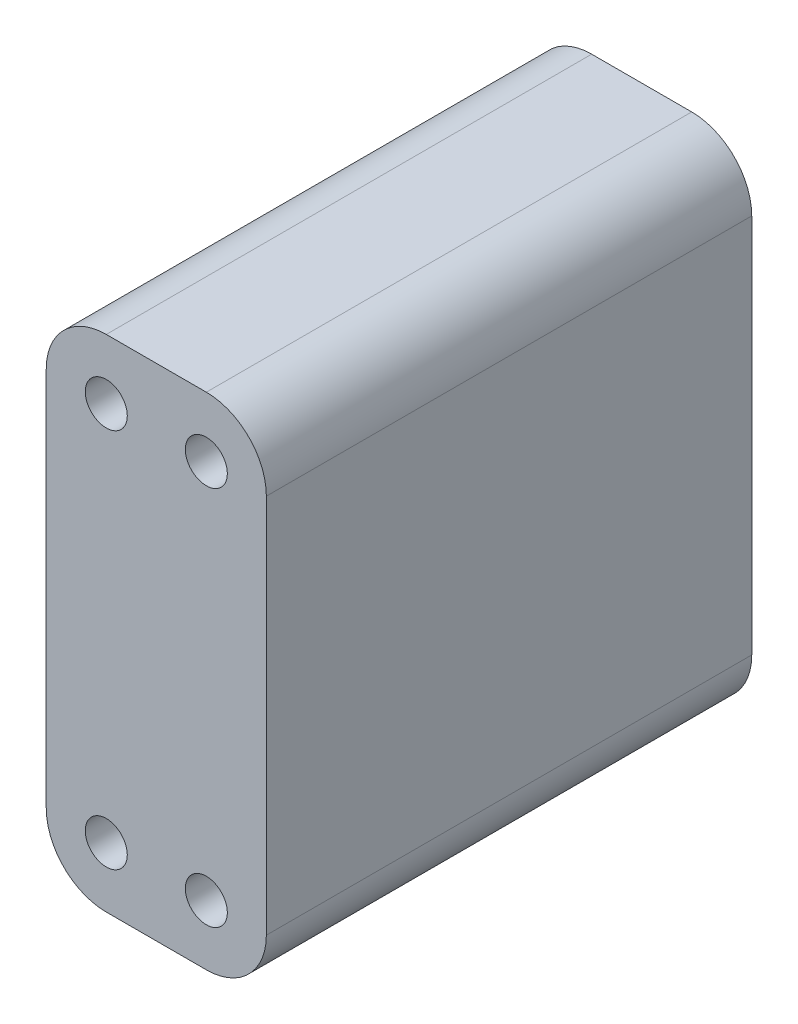
from build123d import *

# Parameters (mm, degrees)
ESQUISSE1_W             = 22
ESQUISSE1_H             = 50
BOSS_EXTRU_1_DEPTH      = 48.514
CONG_1_R                = 6
ESQUISSE2_R             = 2.1
ENL_V_MAT_EXTRU_1_DEPTH = 56.674125013


with BuildPart() as part:
    # Esquisse1 → Boss.-Extru.1 (new body)
    with BuildSketch(Plane.XY):
        Rectangle(ESQUISSE1_W, ESQUISSE1_H)
    extrude(amount=BOSS_EXTRU_1_DEPTH)

    # Congé1
    cong_1_edges = [part.edges().sort_by_distance(p)[0] for p in [
        (-11, 25, 24.257),
        (11, 25, 24.257),
        (11, -25, 24.257),
        (-11, -25, 24.257),
    ]]
    fillet(cong_1_edges, radius=CONG_1_R)

    # Esquisse2 → Enlèv. mat.-Extru.1 (cut, through all)
    with BuildSketch(Plane.XY.offset(48.514)):
        with Locations((-5, 19)):
            Circle(ESQUISSE2_R)
        with Locations((5, 19)):
            Circle(ESQUISSE2_R)
        with Locations((-5, -19)):
            Circle(ESQUISSE2_R)
        with Locations((5, -19)):
            Circle(ESQUISSE2_R)
    extrude(amount=-ENL_V_MAT_EXTRU_1_DEPTH, mode=Mode.SUBTRACT)


solid = part.part
